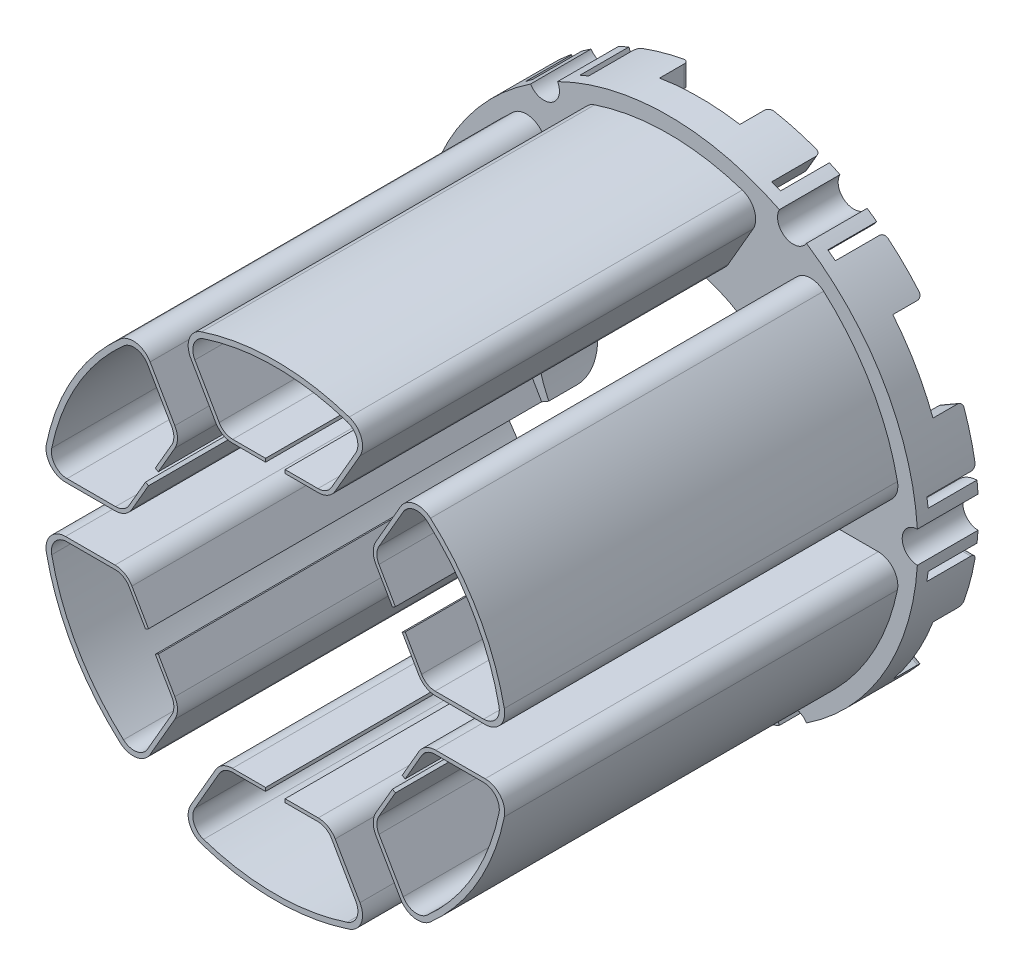
from build123d import *
from build123d.topology import SkipClean

# Parameters (mm, degrees)
Y_KSEKLIK_EKSTR_ZYON1_DEPTH   = 40.2
Y_KSEKLIK_EKSTR_ZYON1_2_DEPTH = 40.2
Y_KSEKLIK_EKSTR_ZYON1_3_DEPTH = 40.2
Y_KSEKLIK_EKSTR_ZYON1_4_DEPTH = 40.2
Y_KSEKLIK_EKSTR_ZYON1_5_DEPTH = 40.2
Y_KSEKLIK_EKSTR_ZYON1_6_DEPTH = 40.2
IZIM2_R                       = 25.5
IZIM2_R_2                     = 13.6
Y_KSEKLIK_EKSTR_ZYON2_DEPTH   = 1.2
KES_EKSTR_ZYON1_DEPTH         = 41.4
KES_EKSTR_ZYON2_START         = -41.4
IZIM4_W                       = 2
IZIM4_H                       = 2.5
KES_EKSTR_ZYON2_DEPTH         = 41.4
RADYUS1_R                     = 2
Y_KSEKLIK_EKSTR_ZYON3_DEPTH   = 5
KES_EKSTR_ZYON3_START         = -3
KES_EKSTR_ZYON3_DEPTH         = 3
Y_KSEKLIK_EKSTR_ZYON4_DEPTH   = 4.7
RADYUS3_R                     = 3
Y_KSEKLIK_EKSTR_ZYON5_DEPTH   = 5
KES_EKSTR_ZYON4_START         = -1.2
KES_EKSTR_ZYON4_DEPTH         = 1.2
RADYUS4_R                     = 0.5


with BuildPart() as part:
    # Çizim1 → Yükseklik-Ekstrüzyon1 (new body)
    with BuildSketch(Plane.XY):
        with BuildLine():
            Line((-5.542562584, 14.4), (5.542562584, 14.4))
            Line((5.542562584, 14.4), (9.811135323, 21.79338486))
            ThreePointArc((9.811135323, 21.79338486), (0, 23.9), (-9.811135323, 21.79338486))
            Line((-9.811135323, 21.79338486), (-5.542562584, 14.4))
        make_face()
    extrude(amount=Y_KSEKLIK_EKSTR_ZYON1_DEPTH)



with BuildPart() as body_2:
    # Çizim1 → Y_kseklik-Ekstr_zyon1 2 (new body)
    with BuildSketch(Plane.XY):
        with BuildLine():
            Line((9.699484522, 12), (15.242047107, 2.4))
            Line((15.242047107, 2.4), (23.779192585, 2.4))
            ThreePointArc((23.779192585, 2.4), (20.69800715, 11.95), (13.968057262, 19.39338486))
            Line((13.968057262, 19.39338486), (9.699484522, 12))
        make_face()
    extrude(amount=Y_KSEKLIK_EKSTR_ZYON1_2_DEPTH)


with BuildPart() as body_3:
    # Çizim1 → Y_kseklik-Ekstr_zyon1 3 (new body)
    with BuildSketch(Plane.XY):
        with BuildLine():
            Line((15.242047107, -2.4), (9.699484522, -12))
            Line((9.699484522, -12), (13.968057262, -19.39338486))
            ThreePointArc((13.968057262, -19.39338486), (20.69800715, -11.95), (23.779192585, -2.4))
            Line((23.779192585, -2.4), (15.242047107, -2.4))
        make_face()
    extrude(amount=Y_KSEKLIK_EKSTR_ZYON1_3_DEPTH)


with BuildPart() as body_4:
    # Çizim1 → Y_kseklik-Ekstr_zyon1 4 (new body)
    with BuildSketch(Plane.XY):
        with BuildLine():
            Line((5.542562584, -14.4), (-5.542562584, -14.4))
            Line((-5.542562584, -14.4), (-9.811135323, -21.79338486))
            ThreePointArc((-9.811135323, -21.79338486), (0, -23.9), (9.811135323, -21.79338486))
            Line((9.811135323, -21.79338486), (5.542562584, -14.4))
        make_face()
    extrude(amount=Y_KSEKLIK_EKSTR_ZYON1_4_DEPTH)


with BuildPart() as body_5:
    # Çizim1 → Y_kseklik-Ekstr_zyon1 5 (new body)
    with BuildSketch(Plane.XY):
        with BuildLine():
            Line((-9.699484522, -12), (-15.242047107, -2.4))
            Line((-15.242047107, -2.4), (-23.779192585, -2.4))
            ThreePointArc((-23.779192585, -2.4), (-20.69800715, -11.95), (-13.968057262, -19.39338486))
            Line((-13.968057262, -19.39338486), (-9.699484522, -12))
        make_face()
    extrude(amount=Y_KSEKLIK_EKSTR_ZYON1_5_DEPTH)


with BuildPart() as body_6:
    # Çizim1 → Y_kseklik-Ekstr_zyon1 6 (new body)
    with BuildSketch(Plane.XY):
        with BuildLine():
            Line((-15.242047107, 2.4), (-9.699484522, 12))
            Line((-9.699484522, 12), (-13.968057262, 19.39338486))
            ThreePointArc((-13.968057262, 19.39338486), (-20.69800715, 11.95), (-23.779192585, 2.4))
            Line((-23.779192585, 2.4), (-15.242047107, 2.4))
        make_face()
    extrude(amount=Y_KSEKLIK_EKSTR_ZYON1_6_DEPTH)


with BuildPart() as part_1:
    add(part.part)

    add(body_2.part)  # Yükseklik-Ekstrüzyon2 merges body 2

    add(body_3.part)  # Yükseklik-Ekstrüzyon2 merges body 3

    add(body_4.part)  # Yükseklik-Ekstrüzyon2 merges body 4

    add(body_5.part)  # Yükseklik-Ekstrüzyon2 merges body 5

    add(body_6.part)  # Yükseklik-Ekstrüzyon2 merges body 6
    # Çizim2 → Yükseklik-Ekstrüzyon2 (add)
    with BuildSketch(Plane(origin=(0, 0, 0), x_dir=(-1, 0, 0), z_dir=(0, 0, -1))):
        Circle(IZIM2_R)
        Circle(IZIM2_R_2, mode=Mode.SUBTRACT)
    extrude(amount=Y_KSEKLIK_EKSTR_ZYON2_DEPTH)

    # Çizim3 → Kes-Ekstrüzyon1 (cut)
    with BuildSketch(Plane.XY.offset(40.2)):
        with BuildLine():
            Line((-10.59437744, 12.75), (-13.075017843, 17.046595214))
            ThreePointArc((-13.075017843, 17.046595214), (-14.205833047, 17.826172371), (-15.524431068, 17.441747046))
            ThreePointArc((-15.524431068, 17.441747046), (-20.221693178, 11.675), (-22.867211562, 4.723678161))
            ThreePointArc((-22.867211562, 4.723678161), (-22.540834649, 3.389526115), (-21.300293425, 2.8))
            Line((-21.300293425, 2.8), (-16.339012618, 2.8))
            ThreePointArc((-16.339012618, 2.8), (-15.539012618, 3.014359354), (-14.953371972, 3.6))
            Line((-14.953371972, 3.6), (-10.59437744, 11.15))
            ThreePointArc((-10.59437744, 11.15), (-10.380018086, 11.95), (-10.59437744, 12.75))
        make_face()
        with BuildLine():
            Line((4.358994532, -14.75), (-4.358994532, -14.75))
            ThreePointArc((-4.358994532, -14.75), (-5.158994532, -14.964359354), (-5.744635178, -15.55))
            Line((-5.744635178, -15.55), (-8.225275582, -19.846595214))
            ThreePointArc((-8.225275582, -19.846595214), (-8.335001602, -21.215698487), (-7.342780494, -22.165425207))
            ThreePointArc((-7.342780494, -22.165425207), (0, -23.35), (7.342780494, -22.165425207))
            ThreePointArc((7.342780494, -22.165425207), (8.335001602, -21.215698487), (8.225275582, -19.846595214))
            Line((8.225275582, -19.846595214), (5.744635178, -15.55))
            ThreePointArc((5.744635178, -15.55), (5.158994532, -14.964359354), (4.358994532, -14.75))
        make_face()
        with BuildLine():
            Line((-16.339012618, -2.8), (-21.300293425, -2.8))
            ThreePointArc((-21.300293425, -2.8), (-22.540834649, -3.389526115), (-22.867211562, -4.723678161))
            ThreePointArc((-22.867211562, -4.723678161), (-20.221693178, -11.675), (-15.524431068, -17.441747046))
            ThreePointArc((-15.524431068, -17.441747046), (-14.205833047, -17.826172371), (-13.075017843, -17.046595214))
            Line((-13.075017843, -17.046595214), (-10.59437744, -12.75))
            ThreePointArc((-10.59437744, -12.75), (-10.380018086, -11.95), (-10.59437744, -11.15))
            Line((-10.59437744, -11.15), (-14.953371972, -3.6))
            ThreePointArc((-14.953371972, -3.6), (-15.539012618, -3.014359354), (-16.339012618, -2.8))
        make_face()
        with BuildLine():
            Line((21.300293425, -2.8), (16.339012618, -2.8))
            ThreePointArc((16.339012618, -2.8), (15.539012618, -3.014359354), (14.953371972, -3.6))
            Line((14.953371972, -3.6), (10.59437744, -11.15))
            ThreePointArc((10.59437744, -11.15), (10.380018086, -11.95), (10.59437744, -12.75))
            Line((10.59437744, -12.75), (13.075017843, -17.046595214))
            ThreePointArc((13.075017843, -17.046595214), (14.205833047, -17.826172371), (15.524431068, -17.441747046))
            ThreePointArc((15.524431068, -17.441747046), (20.221693178, -11.675), (22.867211562, -4.723678161))
            ThreePointArc((22.867211562, -4.723678161), (22.540834649, -3.389526115), (21.300293425, -2.8))
        make_face()
        with BuildLine():
            Line((13.075017843, 17.046595214), (10.59437744, 12.75))
            ThreePointArc((10.59437744, 12.75), (10.380018086, 11.95), (10.59437744, 11.15))
            Line((10.59437744, 11.15), (14.953371972, 3.6))
            ThreePointArc((14.953371972, 3.6), (15.539012618, 3.014359354), (16.339012618, 2.8))
            Line((16.339012618, 2.8), (21.300293425, 2.8))
            ThreePointArc((21.300293425, 2.8), (22.540834649, 3.389526115), (22.867211562, 4.723678161))
            ThreePointArc((22.867211562, 4.723678161), (20.221693178, 11.675), (15.524431068, 17.441747046))
            ThreePointArc((15.524431068, 17.441747046), (14.205833047, 17.826172371), (13.075017843, 17.046595214))
        make_face()
        with BuildLine():
            Line((5.744635178, 15.55), (8.225275582, 19.846595214))
            ThreePointArc((8.225275582, 19.846595214), (8.335001602, 21.215698487), (7.342780494, 22.165425207))
            ThreePointArc((7.342780494, 22.165425207), (0, 23.35), (-7.342780494, 22.165425207))
            ThreePointArc((-7.342780494, 22.165425207), (-8.335001602, 21.215698487), (-8.225275582, 19.846595214))
            Line((-8.225275582, 19.846595214), (-5.744635178, 15.55))
            ThreePointArc((-5.744635178, 15.55), (-5.158994532, 14.964359354), (-4.358994532, 14.75))
            Line((-4.358994532, 14.75), (4.358994532, 14.75))
            ThreePointArc((4.358994532, 14.75), (5.158994532, 14.964359354), (5.744635178, 15.55))
        make_face()
    extrude(amount=-KES_EKSTR_ZYON1_DEPTH, mode=Mode.SUBTRACT)

    # Çizim4 → Kes-Ekstrüzyon2 (cut)
    with BuildSketch(Plane.XY.offset(40.2).offset(KES_EKSTR_ZYON2_START)):
        with Locations((0, 13.5)):
            Rectangle(IZIM4_W, IZIM4_H)
        Polygon((10.108811196, 6.991025404), (12.273874706, 8.241025404), (13.273874706, 6.508974596), (11.108811196, 5.258974596), align=None)
        Polygon((11.108811196, -5.258974596), (13.273874706, -6.508974596), (12.273874706, -8.241025404), (10.108811196, -6.991025404), align=None)
        with Locations((0, -13.5)):
            Rectangle(IZIM4_W, IZIM4_H)
        Polygon((-10.108811196, -6.991025404), (-12.273874706, -8.241025404), (-13.273874706, -6.508974596), (-11.108811196, -5.258974596), align=None)
        Polygon((-11.108811196, 5.258974596), (-13.273874706, 6.508974596), (-12.273874706, 8.241025404), (-10.108811196, 6.991025404), align=None)
    extrude(amount=KES_EKSTR_ZYON2_DEPTH, mode=Mode.SUBTRACT)

    # Radyus1
    radyus1_edges = [part_1.edges().sort_by_distance(p)[0] for p in [
        (5.542562584, 14.4, 20.1),
        (9.811135323, 21.79338486, 20.1),
        (-9.811135323, 21.79338486, 20.1),
        (-5.542562584, 14.4, 20.1),
        (9.699484522, -12, 20.1),
        (13.968057262, -19.39338486, 20.1),
        (23.779192585, -2.4, 20.1),
        (15.242047107, -2.4, 20.1),
        (-5.542562584, -14.4, 20.1),
        (-9.811135323, -21.79338486, 20.1),
        (9.811135323, -21.79338486, 20.1),
        (5.542562584, -14.4, 20.1),
        (-15.242047107, -2.4, 20.1),
        (-23.779192585, -2.4, 20.1),
        (-13.968057262, -19.39338486, 20.1),
        (-9.699484522, -12, 20.1),
        (-9.699484522, 12, 20.1),
        (-13.968057262, 19.39338486, 20.1),
        (-23.779192585, 2.4, 20.1),
        (-15.242047107, 2.4, 20.1),
        (15.242047107, 2.4, 20.1),
        (9.699484522, 12, 20.1),
        (13.968057262, 19.39338486, 20.1),
        (23.779192585, 2.4, 20.1),
    ]]
    fillet(radyus1_edges, radius=RADYUS1_R)

    # Çizim7 → Yükseklik-Ekstrüzyon3 (add)
    with SkipClean():  # the faces are left unmerged after this step: merging them gives an invalid solid
        with BuildSketch(Plane(origin=(0, 0, -1.2), x_dir=(-1, 0, 0), z_dir=(0, 0, -1))):
            with BuildLine():
                Line((8.275859079, 21.834208401), (9.363783526, 23.718548819))
                ThreePointArc((9.363783526, 23.718548819), (0, 25.5), (-9.363783526, 23.718548819))
                Line((-9.363783526, 23.718548819), (-8.275859079, 21.834208401))
                ThreePointArc((-8.275859079, 21.834208401), (0, 23.35), (8.275859079, 21.834208401))
            make_face()
            with BuildLine():
                Line((14.771049607, 18.084208401), (15.858974055, 19.968548819))
                ThreePointArc((15.858974055, 19.968548819), (22.083647797, 12.75), (25.222757581, 3.75))
                Line((25.222757581, 3.75), (23.046908686, 3.75))
                ThreePointArc((23.046908686, 3.75), (20.221693178, 11.675), (14.771049607, 18.084208401))
            make_face()
            with BuildLine():
                Line((23.046908686, -3.75), (25.222757581, -3.75))
                ThreePointArc((25.222757581, -3.75), (22.083647797, -12.75), (15.858974055, -19.968548819))
                Line((15.858974055, -19.968548819), (14.771049607, -18.084208401))
                ThreePointArc((14.771049607, -18.084208401), (20.221693178, -11.675), (23.046908686, -3.75))
            make_face()
            with BuildLine():
                Line((8.275859079, -21.834208401), (9.363783526, -23.718548819))
                ThreePointArc((9.363783526, -23.718548819), (0, -25.5), (-9.363783526, -23.718548819))
                Line((-9.363783526, -23.718548819), (-8.275859079, -21.834208401))
                ThreePointArc((-8.275859079, -21.834208401), (0, -23.35), (8.275859079, -21.834208401))
            make_face()
            with BuildLine():
                Line((-14.771049607, -18.084208401), (-15.858974055, -19.968548819))
                ThreePointArc((-15.858974055, -19.968548819), (-22.083647797, -12.75), (-25.222757581, -3.75))
                Line((-25.222757581, -3.75), (-23.046908686, -3.75))
                ThreePointArc((-23.046908686, -3.75), (-20.221693178, -11.675), (-14.771049607, -18.084208401))
            make_face()
            with BuildLine():
                Line((-23.046908686, 3.75), (-25.222757581, 3.75))
                ThreePointArc((-25.222757581, 3.75), (-22.083647797, 12.75), (-15.858974055, 19.968548819))
                Line((-15.858974055, 19.968548819), (-14.771049607, 18.084208401))
                ThreePointArc((-14.771049607, 18.084208401), (-20.221693178, 11.675), (-23.046908686, 3.75))
            make_face()
        extrude(amount=Y_KSEKLIK_EKSTR_ZYON3_DEPTH)

    # Çizim8 → Kes-Ekstrüzyon3 (cut)
    with SkipClean():  # the faces are left unmerged after this step: merging them gives an invalid solid
        with BuildSketch(Plane(origin=(0, 0, -6.2), x_dir=(-1, 0, 0), z_dir=(0, 0, -1)).offset(KES_EKSTR_ZYON3_START)):
            with BuildLine():
                Line((4.108296055, 25.166881085), (4.097234648, 22.987717769))
                ThreePointArc((4.097234648, 22.987717769), (-0.002808993, 23.349999831), (-4.102765352, 22.986731313))
                Line((-4.102765352, 22.986731313), (-4.102765352, 25.167783305))
                ThreePointArc((-4.102765352, 25.167783305), (0.002801905, 25.499999846), (4.108296055, 25.166881085))
            make_face()
            with BuildLine():
                Line((23.849306381, 9.025551792), (21.956564887, 7.945549594))
                ThreePointArc((21.956564887, 7.945549594), (20.220288535, 11.677432575), (17.855710591, 15.046464677))
                Line((17.855710591, 15.046464677), (19.744557023, 16.136990673))
                ThreePointArc((19.744557023, 16.136990673), (22.085048616, 12.747573402), (23.849306381, 9.025551792))
            make_face()
            with BuildLine():
                Line((19.741010326, -16.141329292), (17.859330239, -15.042168175))
                ThreePointArc((17.859330239, -15.042168175), (20.223097529, -11.672567256), (21.958475943, -7.940266636))
                Line((21.958475943, -7.940266636), (23.847322375, -9.030792632))
                ThreePointArc((23.847322375, -9.030792632), (22.082246711, -12.752426444), (19.741010326, -16.141329292))
            make_face()
            with BuildLine():
                Line((-4.108296055, -25.166881085), (-4.097234648, -22.987717769))
                ThreePointArc((-4.097234648, -22.987717769), (0.002808993, -23.349999831), (4.102765352, -22.986731313))
                Line((4.102765352, -22.986731313), (4.102765352, -25.167783305))
                ThreePointArc((4.102765352, -25.167783305), (-0.002801905, -25.499999846), (-4.108296055, -25.166881085))
            make_face()
            with BuildLine():
                Line((-23.849306381, -9.025551792), (-21.956564887, -7.945549594))
                ThreePointArc((-21.956564887, -7.945549594), (-20.220288535, -11.677432575), (-17.855710591, -15.046464677))
                Line((-17.855710591, -15.046464677), (-19.744557023, -16.136990673))
                ThreePointArc((-19.744557023, -16.136990673), (-22.085048616, -12.747573402), (-23.849306381, -9.025551792))
            make_face()
            with BuildLine():
                Line((-19.741010326, 16.141329292), (-17.859330239, 15.042168175))
                ThreePointArc((-17.859330239, 15.042168175), (-20.223097529, 11.672567256), (-21.958475943, 7.940266636))
                Line((-21.958475943, 7.940266636), (-23.847322375, 9.030792632))
                ThreePointArc((-23.847322375, 9.030792632), (-22.082246711, 12.752426444), (-19.741010326, 16.141329292))
            make_face()
        extrude(amount=KES_EKSTR_ZYON3_DEPTH, mode=Mode.SUBTRACT)

    # Çizim9 → Yükseklik-Ekstrüzyon4 (add)
    with BuildSketch(Plane(origin=(0, 0, -1.2), x_dir=(-1, 0, 0), z_dir=(0, 0, -1))):
        with BuildLine():
            Line((12.201082631, -8.19899888), (11.24606317, -7.647618137))
            ThreePointArc((11.24606317, -7.647618137), (6.8, -11.777945491), (1, -13.563185467))
            Line((1, -13.563185467), (1, -14.665946952))
            ThreePointArc((1, -14.665946952), (7.35, -12.730573436), (12.201082631, -8.19899888))
        make_face()
        with BuildLine():
            Line((-1, -14.665946952), (-1, -13.563185467))
            ThreePointArc((-1, -13.563185467), (-6.8, -11.777945491), (-11.24606317, -7.647618137))
            Line((-11.24606317, -7.647618137), (-12.201082631, -8.19899888))
            ThreePointArc((-12.201082631, -8.19899888), (-7.35, -12.730573436), (-1, -14.665946952))
        make_face()
        with BuildLine():
            Line((-13.201082631, -6.466948072), (-12.24606317, -5.915567329))
            ThreePointArc((-12.24606317, -5.915567329), (-13.6, 0), (-12.24606317, 5.915567329))
            Line((-12.24606317, 5.915567329), (-13.201082631, 6.466948072))
            ThreePointArc((-13.201082631, 6.466948072), (-14.7, 0), (-13.201082631, -6.466948072))
        make_face()
        with BuildLine():
            Line((12.24606317, -5.915567329), (13.201082631, -6.466948072))
            ThreePointArc((13.201082631, -6.466948072), (14.7, 0), (13.201082631, 6.466948072))
            Line((13.201082631, 6.466948072), (12.24606317, 5.915567329))
            ThreePointArc((12.24606317, 5.915567329), (13.6, 0), (12.24606317, -5.915567329))
        make_face()
        with BuildLine():
            Line((11.24606317, 7.647618137), (12.201082631, 8.19899888))
            ThreePointArc((12.201082631, 8.19899888), (7.35, 12.730573436), (1, 14.665946952))
            Line((1, 14.665946952), (1, 13.563185467))
            ThreePointArc((1, 13.563185467), (6.8, 11.777945491), (11.24606317, 7.647618137))
        make_face()
        with BuildLine():
            Line((-1, 13.563185467), (-1, 14.665946952))
            ThreePointArc((-1, 14.665946952), (-7.35, 12.730573436), (-12.201082631, 8.19899888))
            Line((-12.201082631, 8.19899888), (-11.24606317, 7.647618137))
            ThreePointArc((-11.24606317, 7.647618137), (-6.8, 11.777945491), (-1, 13.563185467))
        make_face()
    extrude(amount=Y_KSEKLIK_EKSTR_ZYON4_DEPTH)

    # Radyus3
    radyus3_edges = [part_1.edges().sort_by_distance(p)[0] for p in [
        (11.723572901, 7.923308508, -5.9),
        (1, 14.114566209, -5.9),
        (-1, 14.114566209, -5.9),
        (-11.723572901, 7.923308508, -5.9),
        (12.723572901, -6.191257701, -5.9),
        (12.723572901, 6.191257701, -5.9),
        (1, -14.114566209, -5.9),
        (11.723572901, -7.923308508, -5.9),
        (-11.723572901, -7.923308508, -5.9),
        (-1, -14.114566209, -5.9),
        (-12.723572901, -6.191257701, -5.9),
        (-12.723572901, 6.191257701, -5.9),
    ]]
    fillet(radyus3_edges, radius=RADYUS3_R)

    # Çizim10 → Yükseklik-Ekstrüzyon5 (add)
    with BuildSketch(Plane.XY.offset(-1.2)):
        with BuildLine():
            ThreePointArc((-14.10986054, 21.240570509), (-11.95, 20.69800715), (-11.339943382, 22.839782926))
            ThreePointArc((-11.339943382, 22.839782926), (-10.798928306, 23.100501022), (-10.251923436, 23.348406067))
            ThreePointArc((-10.251923436, 23.348406067), (-11.35, 19.658776666), (-15.094351073, 20.552629167))
            ThreePointArc((-15.094351073, 20.552629167), (-14.606156572, 20.902396757), (-14.10986054, 21.240570509))
        make_face()
        with BuildLine():
            ThreePointArc((11.339943382, 22.839782926), (10.798928306, 23.100501022), (10.251923436, 23.348406067))
            ThreePointArc((10.251923436, 23.348406067), (11.35, 19.658776666), (15.094351073, 20.552629167))
            ThreePointArc((15.094351073, 20.552629167), (14.606156572, 20.902396757), (14.10986054, 21.240570509))
            ThreePointArc((14.10986054, 21.240570509), (11.95, 20.69800715), (11.339943382, 22.839782926))
        make_face()
        with BuildLine():
            ThreePointArc((25.449803922, 1.599212417), (25.405084878, 2.198104265), (25.34627451, 2.7957769))
            ThreePointArc((25.34627451, 2.7957769), (22.7, 0), (25.34627451, -2.7957769))
            ThreePointArc((25.34627451, -2.7957769), (25.405084878, -2.198104265), (25.449803922, -1.599212417))
            ThreePointArc((25.449803922, -1.599212417), (23.9, 0), (25.449803922, 1.599212417))
        make_face()
        with BuildLine():
            ThreePointArc((14.10986054, -21.240570509), (14.606156572, -20.902396757), (15.094351073, -20.552629167))
            ThreePointArc((15.094351073, -20.552629167), (11.35, -19.658776666), (10.251923436, -23.348406067))
            ThreePointArc((10.251923436, -23.348406067), (10.798928306, -23.100501022), (11.339943382, -22.839782926))
            ThreePointArc((11.339943382, -22.839782926), (11.95, -20.69800715), (14.10986054, -21.240570509))
        make_face()
        with BuildLine():
            ThreePointArc((-11.339943382, -22.839782926), (-10.798928306, -23.100501022), (-10.251923436, -23.348406067))
            ThreePointArc((-10.251923436, -23.348406067), (-11.35, -19.658776666), (-15.094351073, -20.552629167))
            ThreePointArc((-15.094351073, -20.552629167), (-14.606156572, -20.902396757), (-14.10986054, -21.240570509))
            ThreePointArc((-14.10986054, -21.240570509), (-11.95, -20.69800715), (-11.339943382, -22.839782926))
        make_face()
        with BuildLine():
            ThreePointArc((-25.449803922, -1.599212417), (-25.405084878, -2.198104265), (-25.34627451, -2.7957769))
            ThreePointArc((-25.34627451, -2.7957769), (-22.7, 0), (-25.34627451, 2.7957769))
            ThreePointArc((-25.34627451, 2.7957769), (-25.405084878, 2.198104265), (-25.449803922, 1.599212417))
            ThreePointArc((-25.449803922, 1.599212417), (-23.9, 0), (-25.449803922, -1.599212417))
        make_face()
    extrude(amount=-Y_KSEKLIK_EKSTR_ZYON5_DEPTH)

    # Çizim11 → Kes-Ekstrüzyon4 (cut)
    with BuildSketch(Plane(origin=(0, 0, -1.2), x_dir=(-1, 0, 0), z_dir=(0, 0, -1)).offset(KES_EKSTR_ZYON4_START)):
        with BuildLine():
            ThreePointArc((-14.10986054, 21.240570509), (-11.95, 20.69800715), (-11.339943382, 22.839782926))
            ThreePointArc((-11.339943382, 22.839782926), (-12.75, 22.083647797), (-14.10986054, 21.240570509))
        make_face()
        with BuildLine():
            ThreePointArc((11.339943382, 22.839782926), (11.95, 20.69800715), (14.10986054, 21.240570509))
            ThreePointArc((14.10986054, 21.240570509), (12.75, 22.083647797), (11.339943382, 22.839782926))
        make_face()
        with BuildLine():
            ThreePointArc((14.10986054, -21.240570509), (11.95, -20.69800715), (11.339943382, -22.839782926))
            ThreePointArc((11.339943382, -22.839782926), (12.75, -22.083647797), (14.10986054, -21.240570509))
        make_face()
        with BuildLine():
            ThreePointArc((-11.339943382, -22.839782926), (-11.95, -20.69800715), (-14.10986054, -21.240570509))
            ThreePointArc((-14.10986054, -21.240570509), (-12.75, -22.083647797), (-11.339943382, -22.839782926))
        make_face()
        with BuildLine():
            ThreePointArc((25.449803922, 1.599212417), (23.9, 0), (25.449803922, -1.599212417))
            ThreePointArc((25.449803922, -1.599212417), (25.5, 0), (25.449803922, 1.599212417))
        make_face()
        with BuildLine():
            ThreePointArc((-25.449803922, -1.599212417), (-23.9, 0), (-25.449803922, 1.599212417))
            ThreePointArc((-25.449803922, 1.599212417), (-25.5, 0), (-25.449803922, -1.599212417))
        make_face()
    extrude(amount=KES_EKSTR_ZYON4_DEPTH, mode=Mode.SUBTRACT)

    # Radyus4
    radyus4_edges = [part_1.edges().sort_by_distance(p)[0] for p in [
        (-8.819821303, 22.77637861, -6.2),
        (8.819821303, 22.77637861, -6.2),
        (-24.134833134, 3.75, -6.2),
        (-15.315011831, 19.02637861, -6.2),
        (-15.315011831, -19.02637861, -6.2),
        (-24.134833134, -3.75, -6.2),
        (8.819821303, -22.77637861, -6.2),
        (-8.819821303, -22.77637861, -6.2),
        (24.134833134, -3.75, -6.2),
        (15.315011831, -19.02637861, -6.2),
        (15.315011831, 19.02637861, -6.2),
        (24.134833134, 3.75, -6.2),
        (4.102765352, 24.077257309, -6.2),
        (-4.102765352, 24.077299427, -6.2),
        (22.902899159, 8.485529634, -6.2),
        (18.800170282, 15.591748734, -6.2),
        (18.800133807, -15.591727675, -6.2),
        (22.902935634, -8.485550693, -6.2),
        (-4.102765352, -24.077257309, -6.2),
        (4.102765352, -24.077299427, -6.2),
        (-22.902899159, -8.485529634, -6.2),
        (-18.800170282, -15.591748734, -6.2),
        (-18.800133807, 15.591727675, -6.2),
        (-22.902935634, 8.485550693, -6.2),
    ]]
    fillet(radyus4_edges, radius=RADYUS4_R)


solid = part_1.part
